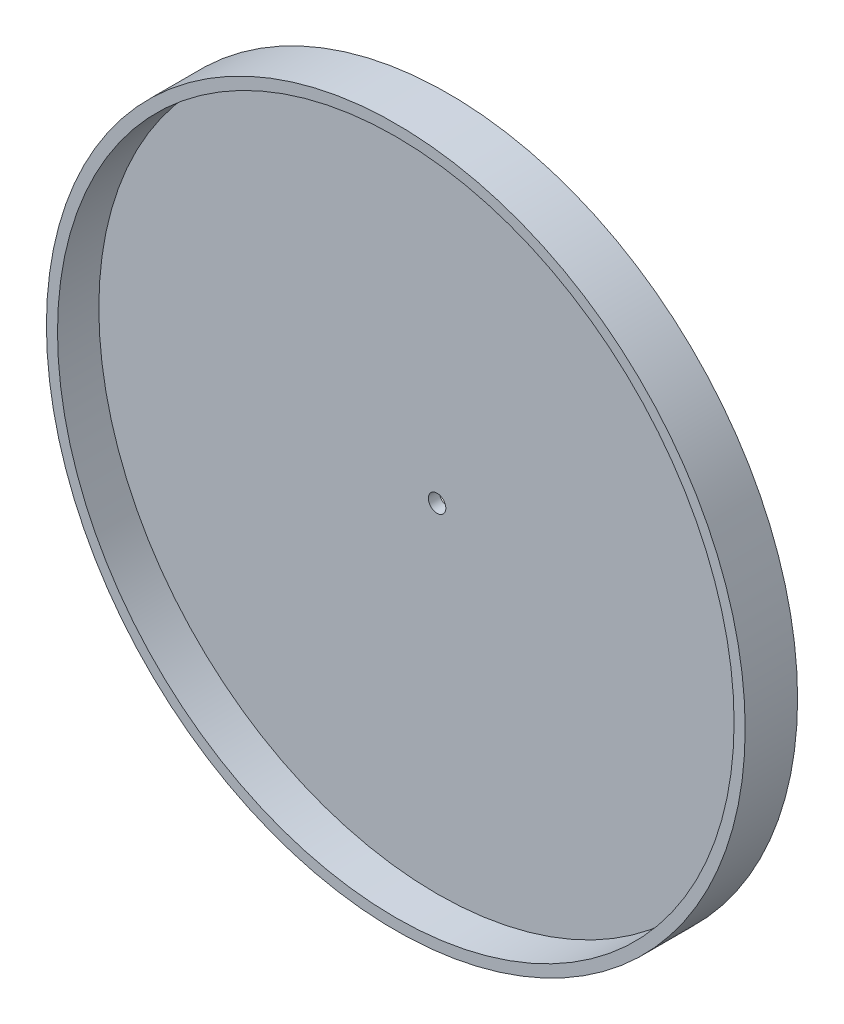
from build123d import *

# Parameters (mm, degrees)
SKETCH1_R           = 100
SKETCH1_R_2         = 2.5
BOSS_EXTRUDE1_DEPTH = 7.5
SKETCH2_R           = 96.825
CUT_EXTRUDE1_DEPTH  = 11.825


with BuildPart() as part:
    # Sketch1 → Boss-Extrude1 (new, symmetric)
    with BuildSketch(Plane.XY):
        Circle(SKETCH1_R)
        Circle(SKETCH1_R_2, mode=Mode.SUBTRACT)
    extrude(amount=BOSS_EXTRUDE1_DEPTH, both=True)

    # Sketch2 → Cut-Extrude1 (cut)
    with BuildSketch(Plane.XY.offset(7.5)):
        Circle(SKETCH2_R)
    extrude(amount=-CUT_EXTRUDE1_DEPTH, mode=Mode.SUBTRACT)


solid = part.part
